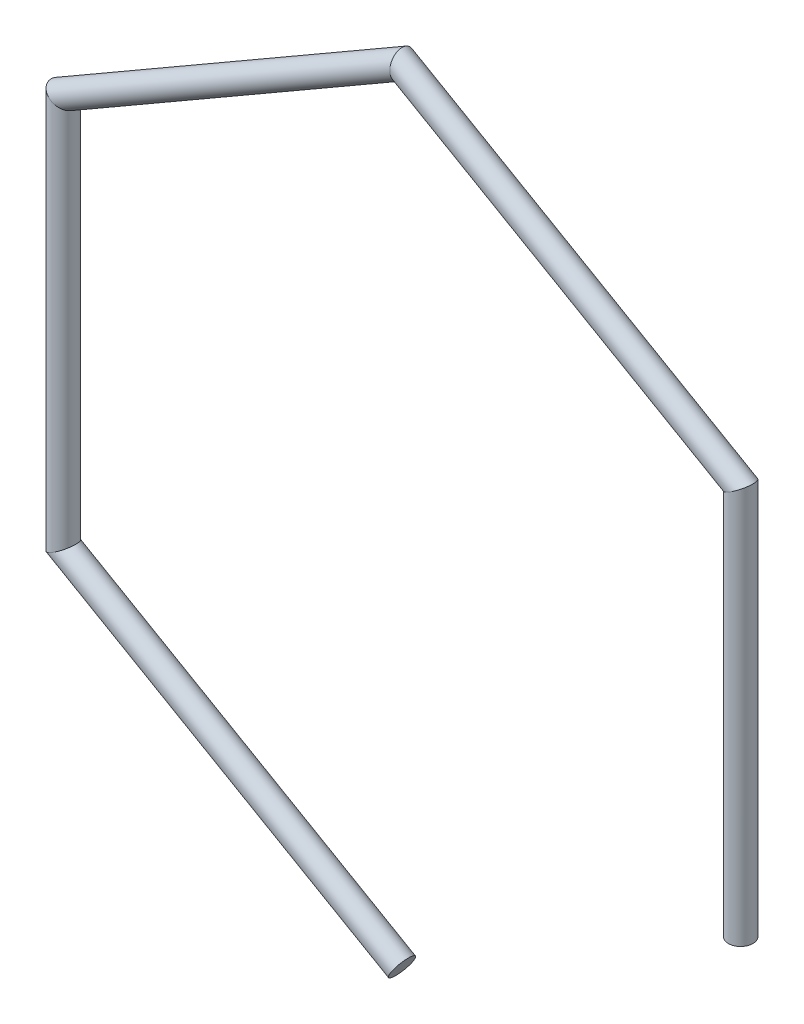
from build123d import *

# Parameters (mm, degrees)
SKETCH2_R = 0.25


with BuildPart() as part:
    # Sweep1: sweep along a path in Sketch1
    with BuildLine(Plane.XY) as sweep1_path:
        Line((0, -8), (-6.92820323, -4))
        Line((-6.92820323, -4), (-6.92820323, 4))
        Line((-6.92820323, 4), (0, 8))
        Line((0, 8), (6.92820323, 4))
        Line((6.92820323, 4), (6.92820323, -4))
    # Sketch2 → Sweep1 (sweep)
    with BuildSketch(Plane(origin=(6.92820323, -4, 0), x_dir=(1, 0, 0), z_dir=(0, 1, 0))):
        Circle(SKETCH2_R)
    sweep(path=sweep1_path.line, transition=Transition.RIGHT)


solid = part.part
